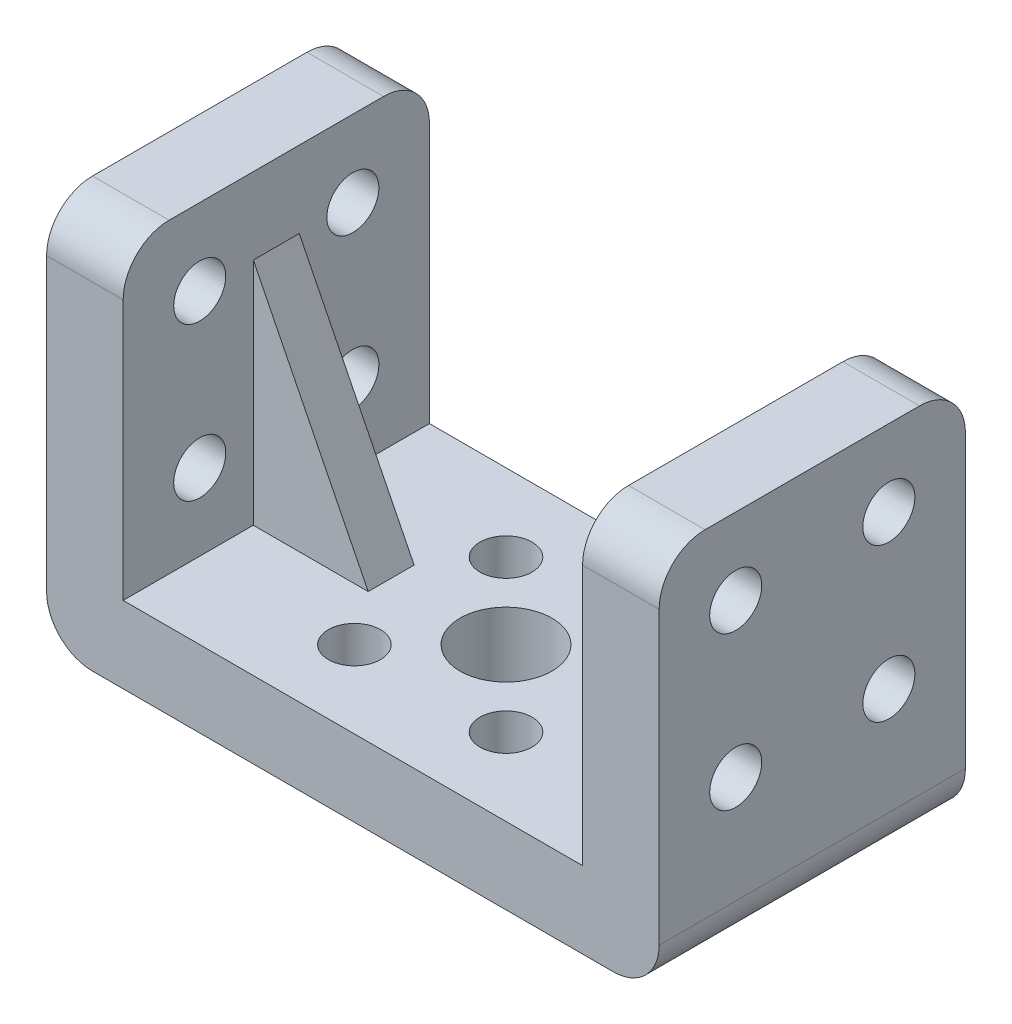
from build123d import *

# Parameters (mm, degrees)
SKETCH_1_W           = 40
SKETCH_1_H           = 20
SKETCH_1_R           = 1.7
SKETCH_1_R_2         = 3
EXTRUDE_1_DEPTH      = 5
SKETCH_2_W           = 5
SKETCH_2_H           = 20
EXTRUDE_2_DEPTH      = 20
EXTRUDE_3_DEPTH      = 1.5
EXTRUDE_3_DEPTH_BACK = 1.5
SKETCH_4_R           = 1.7
CUT_EXTRUDE_1_DEPTH  = 49.218253805
FILLET_1_R           = 3


with BuildPart() as part:
    # 草图1 → 凸台-拉伸1 (new body)
    with BuildSketch(Plane(origin=(0, 0, 0), x_dir=(1, 0, 0), z_dir=(0, 1, 0))):
        Rectangle(SKETCH_1_W, SKETCH_1_H)
        with Locations(Location((4.949747468, 4.949747468, 0), (0, 0, 270))):
            Circle(SKETCH_1_R, mode=Mode.SUBTRACT)
        with Locations(Location((4.949747468, -4.949747468, 0), (0, 0, 270))):
            Circle(SKETCH_1_R, mode=Mode.SUBTRACT)
        with Locations(Location((-4.949747468, -4.949747468, 0), (0, 0, 270))):
            Circle(SKETCH_1_R, mode=Mode.SUBTRACT)
        with Locations(Location((-4.949747468, 4.949747468, 0), (0, 0, 270))):
            Circle(SKETCH_1_R, mode=Mode.SUBTRACT)
        with Locations(Location((0, 0, 0), (0, 0, 270))):
            Circle(SKETCH_1_R_2, mode=Mode.SUBTRACT)
    extrude(amount=EXTRUDE_1_DEPTH)

    # 草图2 → 凸台-拉伸2 (add)
    with BuildSketch(Plane(origin=(0, 5, 0), x_dir=(1, 0, 0), z_dir=(0, 1, 0))):
        with Locations((-17.5, 0)):
            Rectangle(SKETCH_2_W, SKETCH_2_H)
        with Locations((17.5, 0)):
            Rectangle(SKETCH_2_W, SKETCH_2_H)
    extrude(amount=EXTRUDE_2_DEPTH)

    # 草图3 → 凸台-拉伸3 (add, two sides: drawn at the far end of the back side and taken through both)
    with BuildSketch(Plane.XY.offset(-EXTRUDE_3_DEPTH_BACK)):
        Polygon((-15, 20), (-7.5, 5), (-15, 5), align=None)
        Polygon((15, 5), (15, 20), (7.5, 5), align=None)
    extrude(amount=EXTRUDE_3_DEPTH + EXTRUDE_3_DEPTH_BACK)

    # 草图4 → 切除-拉伸1 (cut, through all)
    with BuildSketch(Plane.ZY.offset(20)):
        with Locations((-5, 20)):
            Circle(SKETCH_4_R)
        with Locations((5, 20)):
            Circle(SKETCH_4_R)
        with Locations((5, 10)):
            Circle(SKETCH_4_R)
        with Locations((-5, 10)):
            Circle(SKETCH_4_R)
    extrude(amount=-CUT_EXTRUDE_1_DEPTH, mode=Mode.SUBTRACT)

    # 圆角1
    fillet_1_edges = [part.edges().sort_by_distance(p)[0] for p in [
        (-17.5, 25, 10),
        (-17.5, 25, -10),
        (17.5, 25, -10),
        (17.5, 25, 10),
        (-20, 0, 0),
        (20, 0, 0),
    ]]
    fillet(fillet_1_edges, radius=FILLET_1_R)


solid = part.part
